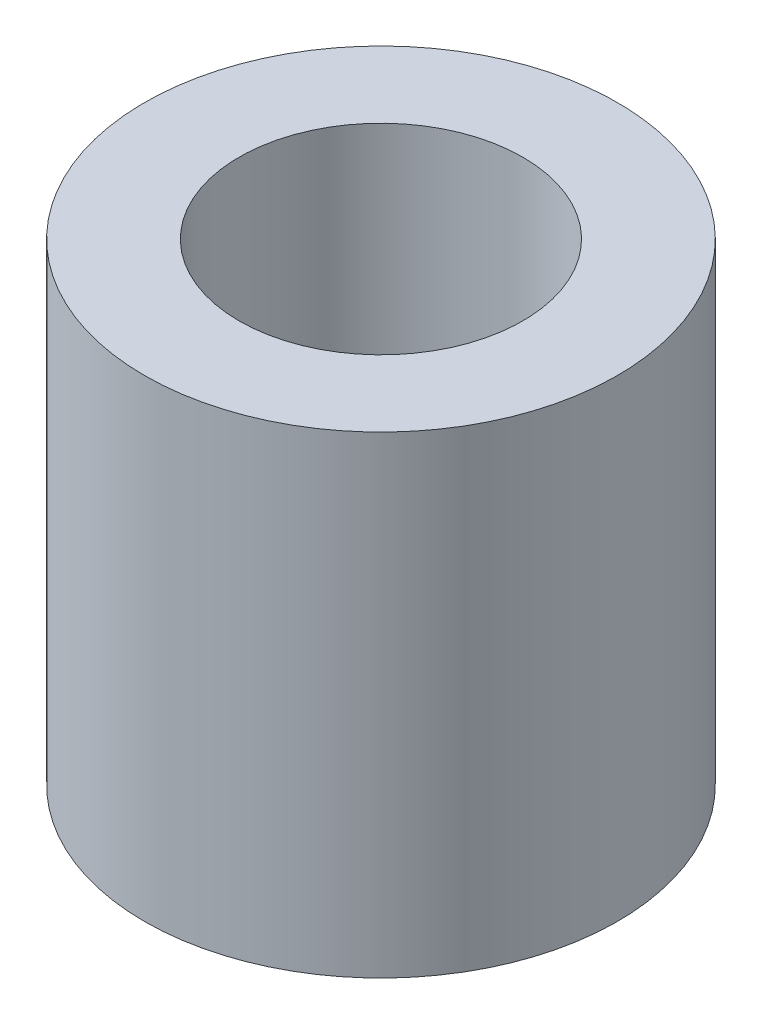
from build123d import *

# Parameters (mm, degrees)
SKETCH_1_R      = 2.5
SKETCH_1_R_2    = 1.5
EXTRUDE_1_DEPTH = 5


with BuildPart() as part:
    # 草图1 → 凸台-拉伸1 (new body)
    with BuildSketch(Plane(origin=(0, 0, 0), x_dir=(1, 0, 0), z_dir=(0, 1, 0))):
        with Locations(Location((0, 0, 0), (0, 0, 270))):
            Circle(SKETCH_1_R)
        with Locations(Location((0, 0, 0), (0, 0, 270))):
            Circle(SKETCH_1_R_2, mode=Mode.SUBTRACT)
    extrude(amount=EXTRUDE_1_DEPTH)


solid = part.part
